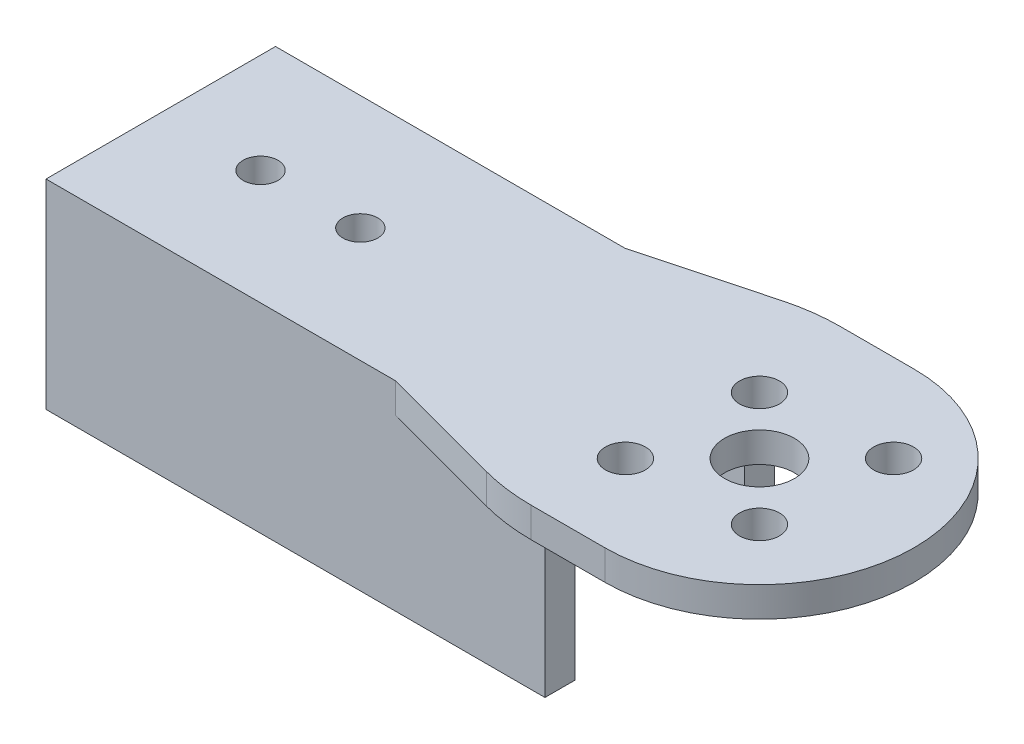
from build123d import *

# Parameters (mm, degrees)
SKETCH1_W           = 50
SKETCH1_H           = 23
BOSS_EXTRUDE1_DEPTH = 20
SKETCH2_W           = 17
SKETCH2_H           = 17
CUT_EXTRUDE1_DEPTH  = 56.065869647
BOSS_EXTRUDE2_DEPTH = 3
SKETCH4_R           = 1.75
SKETCH4_R_2         = 3.5
SKETCH4_R_3         = 2
CUT_EXTRUDE4_DEPTH  = 57.484511151
FILLET1_R           = 20


with BuildPart() as part:
    # Sketch1 → Boss-Extrude1 (new body)
    with BuildSketch(Plane(origin=(0, 0, 0), x_dir=(1, 0, 0), z_dir=(0, 1, 0))):
        Rectangle(SKETCH1_W, SKETCH1_H)
    extrude(amount=BOSS_EXTRUDE1_DEPTH)

    # Sketch2 → Cut-Extrude1 (cut, through all)
    with BuildSketch(Plane(origin=(25, 0, 0), x_dir=(0, 0, -1), z_dir=(1, 0, 0))):
        with Locations((0, 8.5)):
            Rectangle(SKETCH2_W, SKETCH2_H)
    extrude(amount=-CUT_EXTRUDE1_DEPTH, mode=Mode.SUBTRACT)

    # Sketch3 → Boss-Extrude2 (add)
    with BuildSketch(Plane(origin=(0, 20, 0), x_dir=(1, 0, 0), z_dir=(0, 1, 0))):
        with BuildLine():
            Line((25, 15.5), (35, 15.5))
            ThreePointArc((35, 15.5), (50.5, 0), (35, -15.5))
            Line((35, -15.5), (25, -15.5))
            Line((25, -15.5), (10, -11.5))
            Line((10, -11.5), (25, -11.5))
            Line((25, -11.5), (25, 11.5))
            Line((25, 11.5), (10, 11.5))
            Line((10, 11.5), (25, 15.5))
        make_face()
    extrude(amount=-BOSS_EXTRUDE2_DEPTH)

    # Sketch4 → Cut-Extrude4 (cut, through all)
    with BuildSketch(Plane(origin=(0, 20, 0), x_dir=(1, 0, 0), z_dir=(0, 1, 0))):
        with Locations(Location((-15, 0, 0), (0, 0, 270))):
            Circle(SKETCH4_R)
        with Locations(Location((-5, 0, 0), (0, 0, 270))):
            Circle(SKETCH4_R)
        with Locations(Location((35, 0, 0), (0, 0, 270))):
            Circle(SKETCH4_R_2)
        with Locations(Location((28.282485579, -6.717514421, 0), (0, 0, 270))):
            Circle(SKETCH4_R_3)
        with Locations(Location((41.717514421, 6.717514421, 0), (0, 0, 270))):
            Circle(SKETCH4_R_3)
        with Locations(Location((40.727564928, -5.727564928, 0), (0, 0, 270))):
            Circle(SKETCH4_R_3)
        with Locations(Location((29.272435072, 5.727564928, 0), (0, 0, 270))):
            Circle(SKETCH4_R_3)
    extrude(amount=-CUT_EXTRUDE4_DEPTH, mode=Mode.SUBTRACT)

    # Fillet1
    fillet1_edges = [part.edges().sort_by_distance(p)[0] for p in [
        (25, 18.5, -15.5),
        (25, 18.5, 15.5),
    ]]
    fillet(fillet1_edges, radius=FILLET1_R)


solid = part.part
